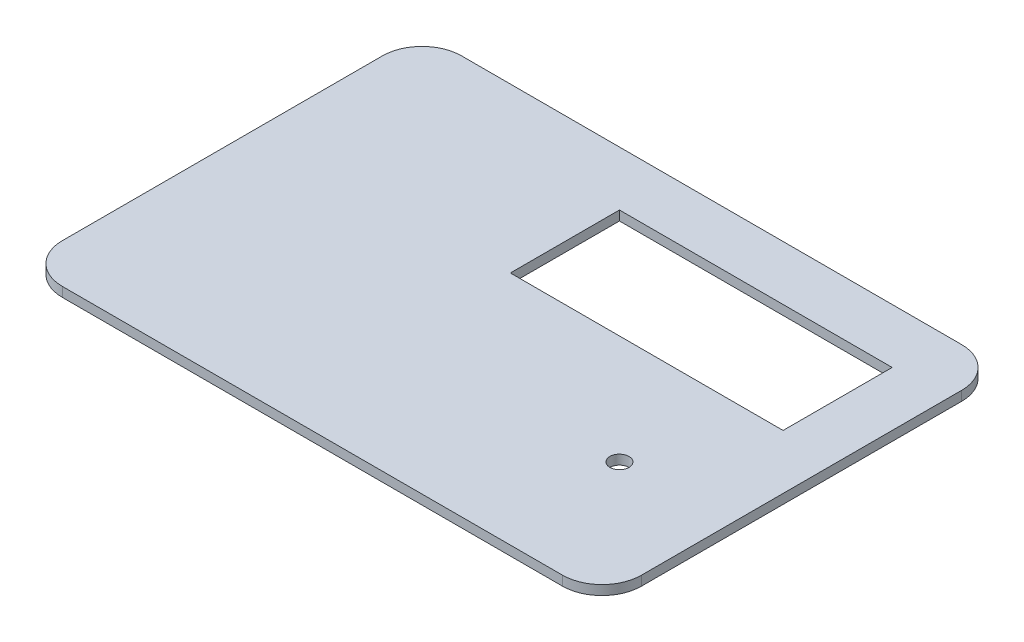
from build123d import *

# Parameters (mm, degrees)
BOSS_EXTRUDE1_DEPTH = 3.5
SKETCH2_R           = 3.5
SKETCH2_W           = 100
SKETCH2_H           = 40
CUT_EXTRUDE1_DEPTH  = 3.5


with BuildPart() as part:
    # Sketch1 → Boss-Extrude1 (new body)
    with BuildSketch(Plane(origin=(0, 0, 0), x_dir=(1, 0, 0), z_dir=(0, 1, 0))):
        with BuildLine():
            Line((-91.7, 73.2), (91.7, 73.2))
            ThreePointArc((91.7, 73.2), (101.953048327, 68.953048327), (106.2, 58.7))
            Line((106.2, 58.7), (106.2, -58.7))
            ThreePointArc((106.2, -58.7), (101.953048327, -68.953048327), (91.7, -73.2))
            Line((91.7, -73.2), (-91.7, -73.2))
            ThreePointArc((-91.7, -73.2), (-101.953048327, -68.953048327), (-106.2, -58.7))
            Line((-106.2, -58.7), (-106.2, 58.7))
            ThreePointArc((-106.2, 58.7), (-101.953048327, 68.953048327), (-91.7, 73.2))
        make_face()
    extrude(amount=BOSS_EXTRUDE1_DEPTH)

    # Sketch2 → Cut-Extrude1 (cut)
    with BuildSketch(Plane(origin=(0, 3.5, 0), x_dir=(1, 0, 0), z_dir=(0, 1, 0))):
        with Locations(Location((66.2, -26.8, 0), (0, 0, 270))):
            Circle(SKETCH2_R)
        with Locations((36.2, 33.2)):
            Rectangle(SKETCH2_W, SKETCH2_H)
    extrude(amount=-CUT_EXTRUDE1_DEPTH, mode=Mode.SUBTRACT)


solid = part.part
